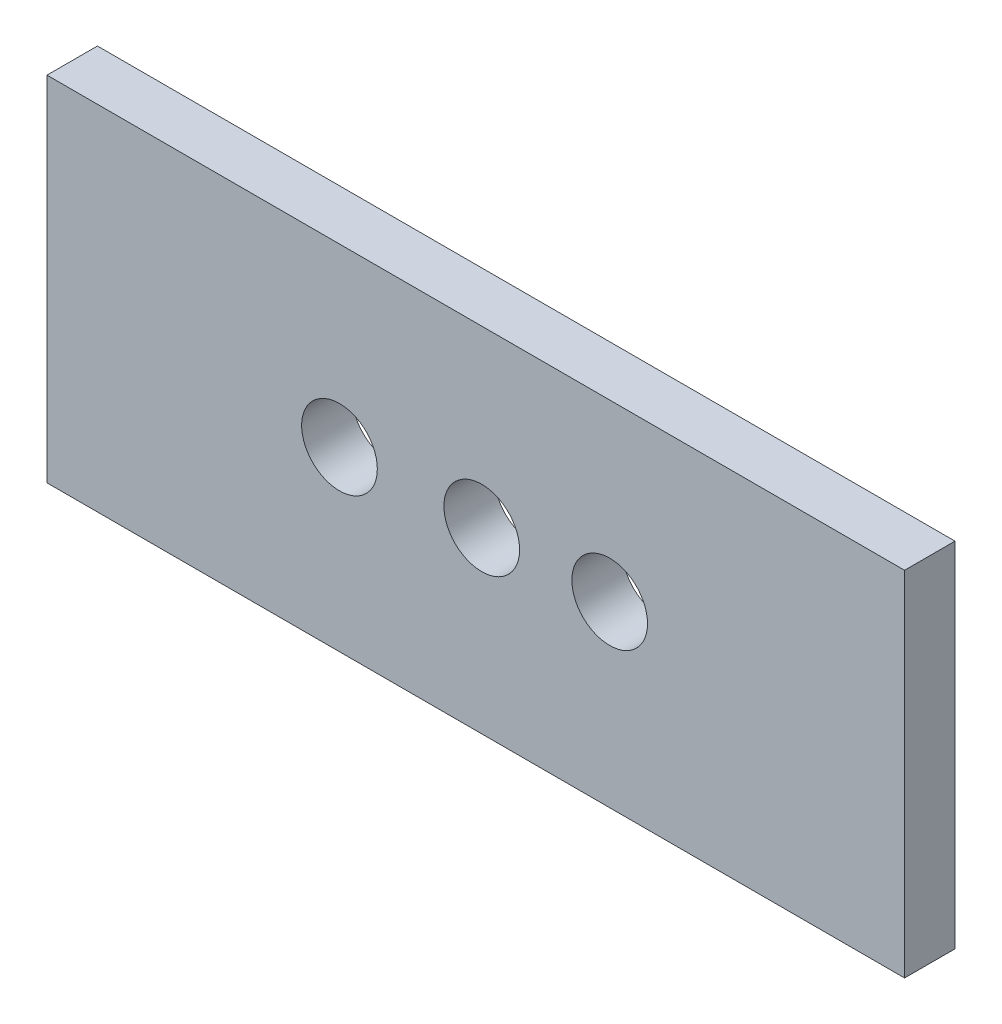
from build123d import *

# Parameters (mm, degrees)
SKETCH1_W           = 34
SKETCH1_H           = 14
BOSS_EXTRUDE1_DEPTH = 2
SKETCH3_R           = 1.5
CUT_EXTRUDE1_DEPTH  = 2
SKETCH4_R           = 1.5
CUT_EXTRUDE2_DEPTH  = 2


with BuildPart() as part:
    # Sketch1 → Boss-Extrude1 (new body)
    with BuildSketch(Plane(origin=(0.099311048, 0, 0), x_dir=(1, 0, 0), z_dir=(0, 0, 1))):
        with Locations((-20.155081556, 54.173525721)):
            Rectangle(SKETCH1_W, SKETCH1_H)
    extrude(amount=BOSS_EXTRUDE1_DEPTH)

    # Sketch3 → Cut-Extrude1 (cut)
    with BuildSketch(Plane(origin=(0.099311048, 0, 2), x_dir=(1, 0, 0), z_dir=(0, 0, 1))):
        with Locations((-25.558678377, 54.197225708)):
            Circle(SKETCH3_R)
    extrude(amount=-CUT_EXTRUDE1_DEPTH, mode=Mode.SUBTRACT)

    # Sketch4 → Cut-Extrude2 (cut)
    with BuildSketch(Plane(origin=(0.099311048, 0, 2), x_dir=(1, 0, 0), z_dir=(0, 0, 1))):
        with Locations((-19.918081695, 54.24462568)):
            Circle(SKETCH4_R)
        with Locations((-14.846284679, 54.24462568)):
            Circle(SKETCH4_R)
    extrude(amount=-CUT_EXTRUDE2_DEPTH, mode=Mode.SUBTRACT)


solid = part.part
